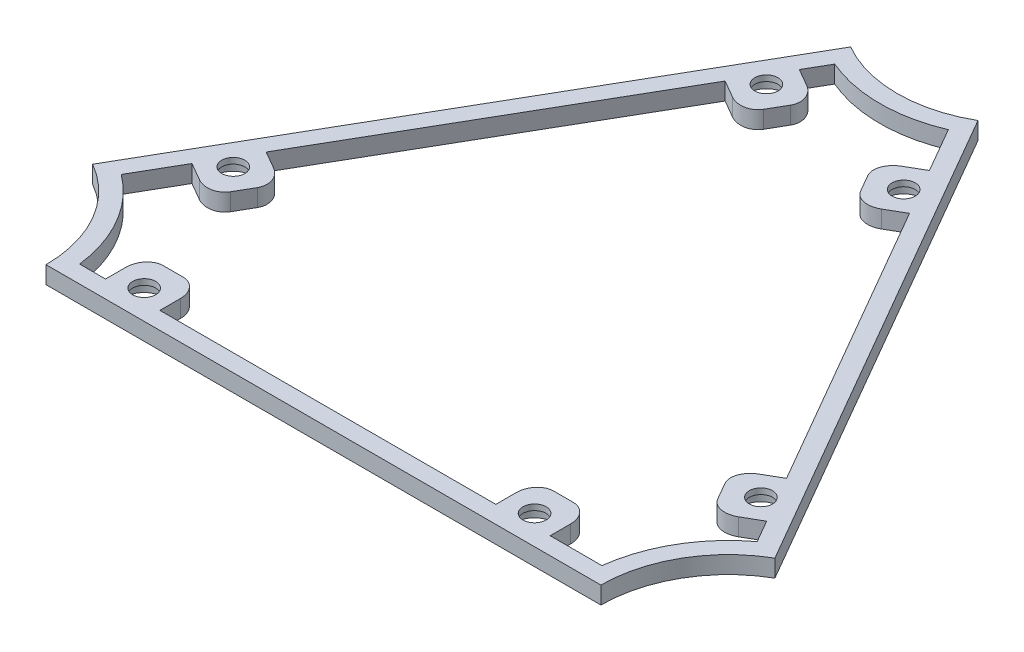
from build123d import *

# Parameters (mm, degrees)
BOSS_EXTRUDE2_DEPTH = 3
SKETCH3_R           = 2
CUT_EXTRUDE1_DEPTH  = 86.498243834
SKETCH5_R           = 3.3
CUT_EXTRUDE3_DEPTH  = 2


with BuildPart() as part:
    # Sketch2 → Boss-Extrude2 (new body)
    with BuildSketch(Plane(origin=(0, 0, 0), x_dir=(1, 0, 0), z_dir=(0, 1, 0))):
        with BuildLine():
            Line((-19.525, -40.436571109), (-48, -40.436571109))
            ThreePointArc((-48, -40.436571109), (-50.952558363, -29.417473287), (-59.019097822, -21.350933827))
            Line((-59.019097822, -21.350933827), (-44.781597822, 3.309139546))
            Line((-44.781597822, 3.309139546), (-25.256597822, 37.127431563))
            Line((-25.256597822, 37.127431563), (-11.019097822, 61.787504936))
            ThreePointArc((-11.019097822, 61.787504936), (0, 58.834946573), (11.019097822, 61.787504936))
            Line((11.019097822, 61.787504936), (25.256597822, 37.127431563))
            Line((25.256597822, 37.127431563), (44.781597822, 3.309139546))
            Line((44.781597822, 3.309139546), (59.019097822, -21.350933827))
            ThreePointArc((59.019097822, -21.350933827), (50.952558363, -29.417473287), (48, -40.436571109))
            Line((48, -40.436571109), (19.525, -40.436571109))
            Line((19.525, -40.436571109), (-19.525, -40.436571109))
        make_face()
        with BuildLine():
            Line((-40.7, -37.436571109), (-40.7, -33.900672724))
            add(Edge.make_bspline(
                [(-37.7, -30.436571109), (-40.7, -30.436571109), (-40.7, -33.900672724)],
                knots=[0, 0, 0, 1.570796327, 1.570796327, 1.570796327], degree=2, weights=[1, 0.707106781, 1]))
            Line((-37.7, -30.436571109), (-34.3, -30.436571109))
            add(Edge.make_bspline(
                [(-31.3, -33.900672724), (-31.3, -30.436571109), (-34.3, -30.436571109)],
                knots=[4.71238898, 4.71238898, 4.71238898, 6.283185307, 6.283185307, 6.283185307], degree=2, weights=[1, 0.707106781, 1]))
            Line((-31.3, -33.900672724), (-31.3, -37.436571109))
            Line((-31.3, -37.436571109), (-19.525, -37.436571109))
            Line((-19.525, -37.436571109), (19.525, -37.436571109))
            Line((19.525, -37.436571109), (26.825, -37.436571109))
            Line((26.825, -37.436571109), (26.825, -33.900672724))
            add(Edge.make_bspline(
                [(29.825, -30.436571109), (26.825, -30.436571109), (26.825, -33.900672724)],
                knots=[3.141592654, 3.141592654, 3.141592654, 4.71238898, 4.71238898, 4.71238898], degree=2, weights=[1, 0.707106781, 1]))
            Line((29.825, -30.436571109), (33.225, -30.436571109))
            add(Edge.make_bspline(
                [(36.225, -33.900672724), (36.225, -30.436571109), (33.225, -30.436571109)],
                knots=[1.570796327, 1.570796327, 1.570796327, 3.141592654, 3.141592654, 3.141592654], degree=2, weights=[1, 0.707106781, 1]))
            Line((36.225, -33.900672724), (36.225, -37.436571109))
            Line((36.225, -37.436571109), (45.180375122, -37.436571109))
            ThreePointArc((45.180375122, -37.436571109), (48.354482151, -27.917473287), (55.011209172, -20.409067054))
            Line((55.011209172, -20.409067054), (52.771021611, -16.528948379))
            Line((52.771021611, -16.528948379), (49.708843785, -18.296897572))
            add(Edge.make_bspline(
                [(45.208843785, -17.430872168), (46.708843785, -20.028948379), (49.708843785, -18.296897572)],
                knots=[0, 0, 0, 1.570796327, 1.570796327, 1.570796327], degree=2, weights=[1, 0.707106781, 1]))
            Line((45.208843785, -17.430872168), (43.508843785, -14.486385795))
            add(Edge.make_bspline(
                [(45.008843785, -10.156258776), (42.008843785, -11.888309584), (43.508843785, -14.486385795)],
                knots=[4.71238898, 4.71238898, 4.71238898, 6.283185307, 6.283185307, 6.283185307], degree=2, weights=[1, 0.707106781, 1]))
            Line((45.008843785, -10.156258776), (48.071021611, -8.388309584))
            Line((48.071021611, -8.388309584), (42.183521611, 1.809139546))
            Line((42.183521611, 1.809139546), (22.658521611, 35.627431563))
            Line((22.658521611, 35.627431563), (19.008521611, 41.949417011))
            Line((19.008521611, 41.949417011), (15.946343785, 40.181467819))
            add(Edge.make_bspline(
                [(11.446343785, 41.047493222), (12.946343785, 38.449417011), (15.946343785, 40.181467819)],
                knots=[3.141592654, 3.141592654, 3.141592654, 4.71238898, 4.71238898, 4.71238898], degree=2, weights=[1, 0.707106781, 1]))
            Line((11.446343785, 41.047493222), (9.746343785, 43.991979595))
            add(Edge.make_bspline(
                [(11.246343785, 48.322106614), (8.246343785, 46.590055807), (9.746343785, 43.991979595)],
                knots=[1.570796327, 1.570796327, 1.570796327, 3.141592654, 3.141592654, 3.141592654], degree=2, weights=[1, 0.707106781, 1]))
            Line((11.246343785, 48.322106614), (14.308521611, 50.090055807))
            Line((14.308521611, 50.090055807), (9.83083405, 57.845638163))
            ThreePointArc((9.83083405, 57.845638163), (0, 55.834946573), (-9.83083405, 57.845638163))
            Line((-9.83083405, 57.845638163), (-12.071021611, 53.965519489))
            Line((-12.071021611, 53.965519489), (-9.008843785, 52.197570296))
            add(Edge.make_bspline(
                [(-7.508843785, 47.867443277), (-6.008843785, 50.465519489), (-9.008843785, 52.197570296)],
                knots=[0, 0, 0, 1.570796327, 1.570796327, 1.570796327], degree=2, weights=[1, 0.707106781, 1]))
            Line((-7.508843785, 47.867443277), (-9.208843785, 44.922956904))
            add(Edge.make_bspline(
                [(-13.708843785, 44.056931501), (-10.708843785, 42.324880693), (-9.208843785, 44.922956904)],
                knots=[4.71238898, 4.71238898, 4.71238898, 6.283185307, 6.283185307, 6.283185307], degree=2, weights=[1, 0.707106781, 1]))
            Line((-13.708843785, 44.056931501), (-16.771021611, 45.824880693))
            Line((-16.771021611, 45.824880693), (-22.658521611, 35.627431563))
            Line((-22.658521611, 35.627431563), (-42.183521611, 1.809139546))
            Line((-42.183521611, 1.809139546), (-45.833521611, -4.512845902))
            Line((-45.833521611, -4.512845902), (-42.771343785, -6.280795094))
            add(Edge.make_bspline(
                [(-41.271343785, -10.610922113), (-39.771343785, -8.012845902), (-42.771343785, -6.280795094)],
                knots=[3.141592654, 3.141592654, 3.141592654, 4.71238898, 4.71238898, 4.71238898], degree=2, weights=[1, 0.707106781, 1]))
            Line((-41.271343785, -10.610922113), (-42.971343785, -13.555408486))
            add(Edge.make_bspline(
                [(-47.471343785, -14.42143389), (-44.471343785, -16.153484698), (-42.971343785, -13.555408486)],
                knots=[1.570796327, 1.570796327, 1.570796327, 3.141592654, 3.141592654, 3.141592654], degree=2, weights=[1, 0.707106781, 1]))
            Line((-47.471343785, -14.42143389), (-50.533521611, -12.653484698))
            Line((-50.533521611, -12.653484698), (-55.011209172, -20.409067054))
            ThreePointArc((-55.011209172, -20.409067054), (-48.354482151, -27.917473287), (-45.180375122, -37.436571109))
            Line((-45.180375122, -37.436571109), (-40.7, -37.436571109))
        make_face(mode=Mode.SUBTRACT)
    extrude(amount=BOSS_EXTRUDE2_DEPTH)

    # Sketch3 → Cut-Extrude1 (cut, through all)
    with BuildSketch(Plane(origin=(0, 3, 0), x_dir=(1, 0, 0), z_dir=(0, 1, 0))):
        with Locations(Location((31.525, -35.436571109, 0), (0, 0, 270))):
            Circle(SKETCH3_R)
        with Locations(Location((-36, -35.452596513, 0), (0, 0, 270))):
            Circle(SKETCH3_R)
        with Locations(Location((-46.451470804, -9.5831653, 0), (0, 0, 270))):
            Circle(SKETCH3_R)
        with Locations(Location((48.70284921, -13.45061628, 0), (0, 0, 270))):
            Circle(SKETCH3_R)
        with Locations(Location((14.926470804, 45.019736409, 0), (0, 0, 270))):
            Circle(SKETCH3_R)
        with Locations(Location((-12.70284921, 48.903212793, 0), (0, 0, 270))):
            Circle(SKETCH3_R)
    extrude(amount=-CUT_EXTRUDE1_DEPTH, mode=Mode.SUBTRACT)

    # Sketch5 → Cut-Extrude3 (cut)
    with BuildSketch(Plane.XZ):
        with Locations(Location((48.70284921, 13.45061628, 0), (0, 0, 270))):
            Circle(SKETCH5_R)
        with Locations(Location((31.525, 35.436571109, 0), (0, 0, 270))):
            Circle(SKETCH5_R)
        with Locations(Location((-12.70284921, -48.903212793, 0), (0, 0, 270))):
            Circle(SKETCH5_R)
        with Locations(Location((14.926470804, -45.019736409, 0), (0, 0, 270))):
            Circle(SKETCH5_R)
        with Locations(Location((-36, 35.452596513, 0), (0, 0, 270))):
            Circle(SKETCH5_R)
        with Locations(Location((-46.451470804, 9.5831653, 0), (0, 0, 270))):
            Circle(SKETCH5_R)
    extrude(amount=-CUT_EXTRUDE3_DEPTH, mode=Mode.SUBTRACT)


solid = part.part
